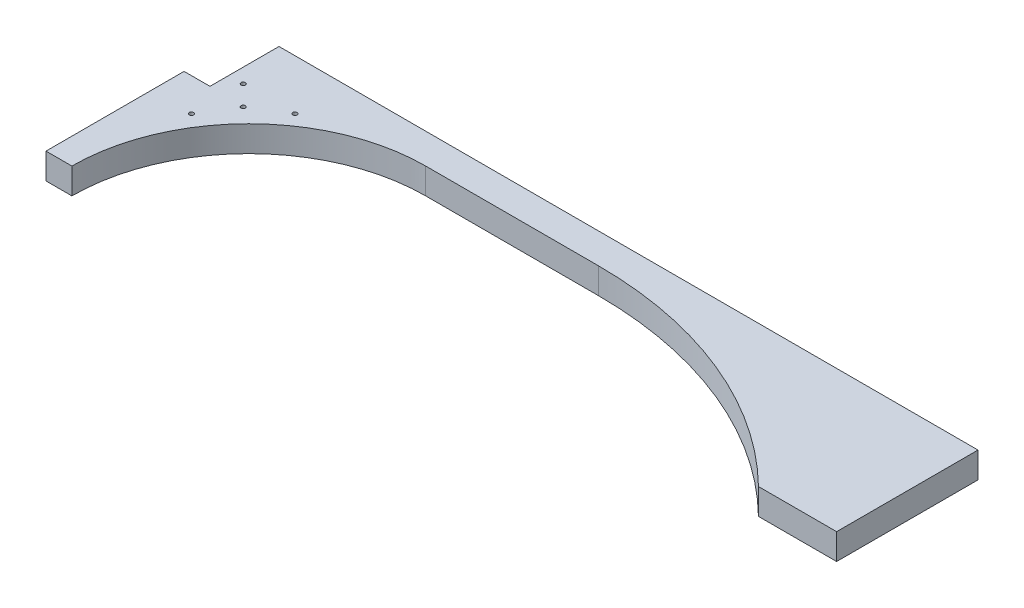
from build123d import *

# Parameters (mm, degrees)
BOSS_EXTRUDE1_DEPTH              = 19.05
F_1_8_0_125_DIAMETER_HOLE1_D     = 3.175
F_1_8_0_125_DIAMETER_HOLE1_DEPTH = 11.1252
F_1_8_0_125_DIAMETER_HOLE1_TIP   = 0.953866233
F_1_8_0_125_DIAMETER_HOLE2_D     = 3.175


with BuildPart() as part:
    # Sketch1 → Boss-Extrude1 (new body)
    with BuildSketch(Plane(origin=(0, 0, 0), x_dir=(1, 0, 0), z_dir=(0, 1, 0))):
        with BuildLine():
            Line((-257.175, 0), (257.175, 0))
            Line((257.175, 0), (257.175, -104.032493436))
            Line((257.175, -104.032493436), (199.670208733, -104.032493436))
            ThreePointArc((199.670208733, -104.032493436), (107.889594305, -43.469891278), (0, -22.225))
            Line((0, -22.225), (-127, -22.225))
            ThreePointArc((-127, -22.225), (-219.047625241, -60.352374759), (-257.175, -152.4))
            Line((-257.175, -152.4), (-276.225, -152.4))
            Line((-276.225, -152.4), (-276.225, -50.8))
            Line((-276.225, -50.8), (-257.175, -50.8))
            Line((-257.175, -50.8), (-257.175, 0))
        make_face()
    extrude(amount=BOSS_EXTRUDE1_DEPTH)

    # 1/8 (0.125) Diameter Hole1
    with Locations(Plane(origin=(0, 0, 0), x_dir=(-1, 0, 0), z_dir=(0, -1, 0))):
        with Locations((0, -11.1125), (225.425, -23.8125), (-225.425, -23.8125), (-225.425, -67.519993436), (257.175, -84.6005531)):
            Hole(F_1_8_0_125_DIAMETER_HOLE1_D / 2, depth=F_1_8_0_125_DIAMETER_HOLE1_DEPTH)
            with Locations((0, 0, -(F_1_8_0_125_DIAMETER_HOLE1_DEPTH + F_1_8_0_125_DIAMETER_HOLE1_TIP / 2))):  # 118° drill point
                Cone(0, F_1_8_0_125_DIAMETER_HOLE1_D / 2, F_1_8_0_125_DIAMETER_HOLE1_TIP, mode=Mode.SUBTRACT)

    # 1/8 (0.125) Diameter Hole2 (through all)
    with Locations(Plane(origin=(0, 19.05, 0), x_dir=(1, 0, 0), z_dir=(0, 1, 0))):
        with Locations((-246.552544448, -36.961239505), (-208.452544448, -36.961239505), (-246.552544448, -75.061239505), (-231.830017346, -51.683766607)):
            Hole(F_1_8_0_125_DIAMETER_HOLE2_D / 2)


solid = part.part
